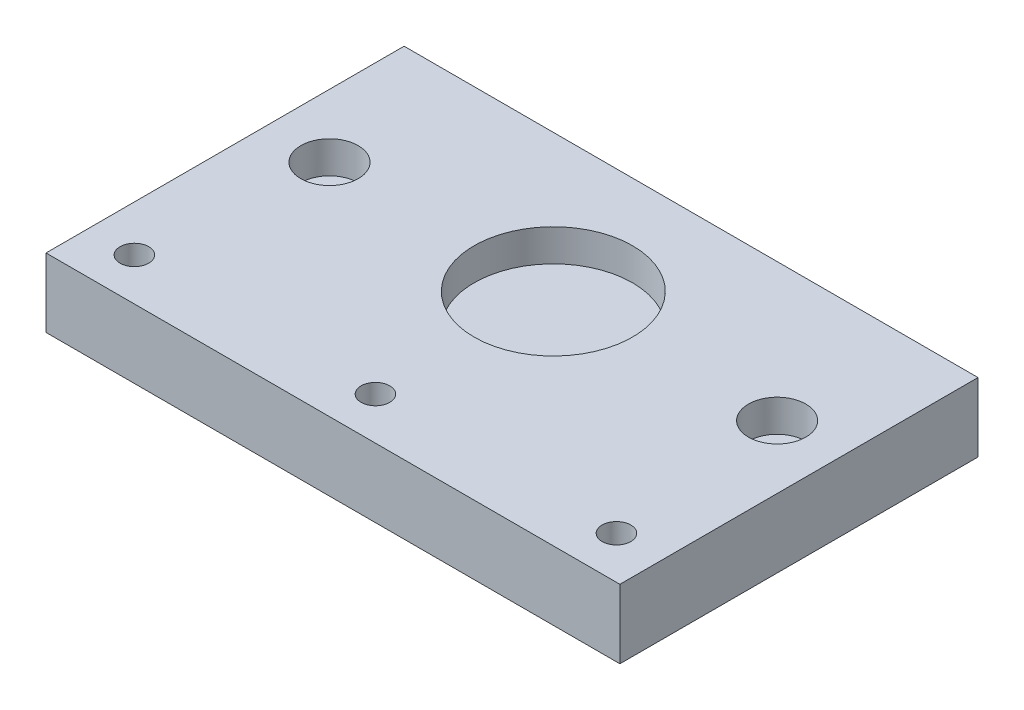
from build123d import *

# Parameters (mm, degrees)
SKETCH1_W           = 63.5
SKETCH1_H           = 25.4
BOSS_EXTRUDE1_DEPTH = 38.1
SKETCH2_R           = 3.175
CUT_EXTRUDE1_DEPTH  = 12.7
SKETCH2_3_R         = 8.763
CUT_EXTRUDE2_DEPTH  = 4.826
CUT_EXTRUDE3_START  = -20.574
SKETCH3_R           = 6.35
CUT_EXTRUDE3_DEPTH  = 20.574
SKETCH4_R           = 10.795
CUT_EXTRUDE4_DEPTH  = 19.05
SKETCH5_R           = 1.5875
CUT_EXTRUDE5_DEPTH  = 50.8
SKETCH6_W           = 63.5
SKETCH6_H           = 1.27
CUT_EXTRUDE6_DEPTH  = 38.1
SKETCH7_W           = 63.5
SKETCH7_H           = 24.13
BOSS_EXTRUDE2_DEPTH = 1.524
SKETCH8_W           = 95.143419866
SKETCH8_H           = 69.172862942
CUT_EXTRUDE7_DEPTH  = 55.231230633
SKETCH9_W           = 63.5
SKETCH9_H           = 39.624
SKETCH9_R           = 1.5875
SKETCH9_R_2         = 3.175
SKETCH9_R_3         = 8.763
BOSS_EXTRUDE3_DEPTH = 2.54
SKETCH10_R          = 8.763
SKETCH10_R_2        = 6.35
CUT_EXTRUDE9_DEPTH  = 52.343824127
SKETCH11_R          = 8.763
SKETCH11_R_2        = 3.175
BOSS_EXTRUDE5_DEPTH = 4.064


with BuildPart() as part:
    # Sketch1 → Boss-Extrude1 (new body)
    with BuildSketch(Plane.XY):
        Rectangle(SKETCH1_W, SKETCH1_H)
    extrude(amount=BOSS_EXTRUDE1_DEPTH)

    # Sketch2 → Cut-Extrude1 (cut)
    with BuildSketch(Plane.XZ.offset(12.7)):
        with Locations(Location((-24.765, 15.24, 0), (0, 0, 270))):
            Circle(SKETCH2_R)
        with Locations(Location((24.765, 15.24, 0), (0, 0, 270))):
            Circle(SKETCH2_R)
    extrude(amount=-CUT_EXTRUDE1_DEPTH, mode=Mode.SUBTRACT)

    # Sketch2<3> → Cut-Extrude2 (cut)
    with BuildSketch(Plane.XZ.offset(12.7)):
        with Locations(Location((0, 15.24, 0), (0, 0, 270))):
            Circle(SKETCH2_3_R)
    extrude(amount=-CUT_EXTRUDE2_DEPTH, mode=Mode.SUBTRACT)

    # Sketch3 → Cut-Extrude3 (cut)
    with BuildSketch(Plane.XZ.offset(7.874).offset(CUT_EXTRUDE3_START)):
        with Locations(Location((0, 15.24, 0), (0, 0, 270))):
            Circle(SKETCH3_R)
    extrude(amount=CUT_EXTRUDE3_DEPTH, mode=Mode.SUBTRACT)

    # Sketch4 → Cut-Extrude4 (cut)
    with BuildSketch(Plane(origin=(0, 12.7, 0), x_dir=(1, 0, 0), z_dir=(0, 1, 0))):
        with Locations(Location((0, -15.24, 0), (0, 0, 270))):
            Circle(SKETCH4_R)
    extrude(amount=-CUT_EXTRUDE4_DEPTH, mode=Mode.SUBTRACT)

    # Sketch5 → Cut-Extrude5 (cut)
    with BuildSketch(Plane(origin=(0, 12.7, 0), x_dir=(1, 0, 0), z_dir=(0, 1, 0))):
        with Locations(Location((-26.67, -34.925, 0), (0, 0, 270))):
            Circle(SKETCH5_R)
        with Locations(Location((0, -34.925, 0), (0, 0, 270))):
            Circle(SKETCH5_R)
        with Locations(Location((26.67, -34.925, 0), (0, 0, 270))):
            Circle(SKETCH5_R)
    extrude(amount=-CUT_EXTRUDE5_DEPTH, mode=Mode.SUBTRACT)

    # Sketch6 → Cut-Extrude6 (cut)
    with BuildSketch(Plane.XY.offset(38.1)):
        with Locations((0, -12.065)):
            Rectangle(SKETCH6_W, SKETCH6_H)
    extrude(amount=-CUT_EXTRUDE6_DEPTH, mode=Mode.SUBTRACT)

    # Sketch7 → Boss-Extrude2 (add)
    with BuildSketch(Plane.XY.offset(38.1)):
        with Locations((0, 0.635)):
            Rectangle(SKETCH7_W, SKETCH7_H)
    extrude(amount=BOSS_EXTRUDE2_DEPTH)

    # Sketch8 → Cut-Extrude7 (cut, through all)
    with BuildSketch(Plane(origin=(0, -6.35, 0), x_dir=(1, 0, 0), z_dir=(0, 1, 0))):
        with Locations((5.084942731, -21.829519101)):
            Rectangle(SKETCH8_W, SKETCH8_H)
    extrude(amount=CUT_EXTRUDE7_DEPTH, mode=Mode.SUBTRACT)

    # Sketch9 → Boss-Extrude3 (add)
    with BuildSketch(Plane.XZ.offset(11.43)):
        with Locations((0, 19.812)):
            Rectangle(SKETCH9_W, SKETCH9_H)
        with Locations(Location((26.67, 34.925, 0), (0, 0, 90))):
            Circle(SKETCH9_R, mode=Mode.SUBTRACT)
        with Locations(Location((0, 34.925, 0), (0, 0, 90))):
            Circle(SKETCH9_R, mode=Mode.SUBTRACT)
        with Locations(Location((-26.67, 34.925, 0), (0, 0, 90))):
            Circle(SKETCH9_R, mode=Mode.SUBTRACT)
        with Locations(Location((-24.765, 15.24, 0), (0, 0, 270))):
            Circle(SKETCH9_R_2, mode=Mode.SUBTRACT)
        with Locations(Location((0, 15.24, 0), (0, 0, 270))):
            Circle(SKETCH9_R_3, mode=Mode.SUBTRACT)
        with Locations(Location((24.765, 15.24, 0), (0, 0, 270))):
            Circle(SKETCH9_R_2, mode=Mode.SUBTRACT)
    extrude(amount=BOSS_EXTRUDE3_DEPTH)

    # Sketch10 → Cut-Extrude9 (cut, through all)
    with BuildSketch(Plane.XZ.offset(13.97)):
        with Locations(Location((0, 15.24, 0), (0, 0, 270))):
            Circle(SKETCH10_R)
        with Locations((0, 15.24)):
            Circle(SKETCH10_R_2, mode=Mode.SUBTRACT)
    extrude(amount=-CUT_EXTRUDE9_DEPTH, mode=Mode.SUBTRACT)

    # Sketch11 → Boss-Extrude5 (add)
    with BuildSketch(Plane.XZ.offset(13.97)):
        with Locations(Location((0, 15.24, 0), (0, 0, 270))):
            Circle(SKETCH11_R)
        with Locations(Location((24.765, 15.24, 0), (0, 0, 270))):
            Circle(SKETCH11_R_2)
        with Locations(Location((-24.765, 15.24, 0), (0, 0, 270))):
            Circle(SKETCH11_R_2)
    extrude(amount=-BOSS_EXTRUDE5_DEPTH)


solid = part.part
